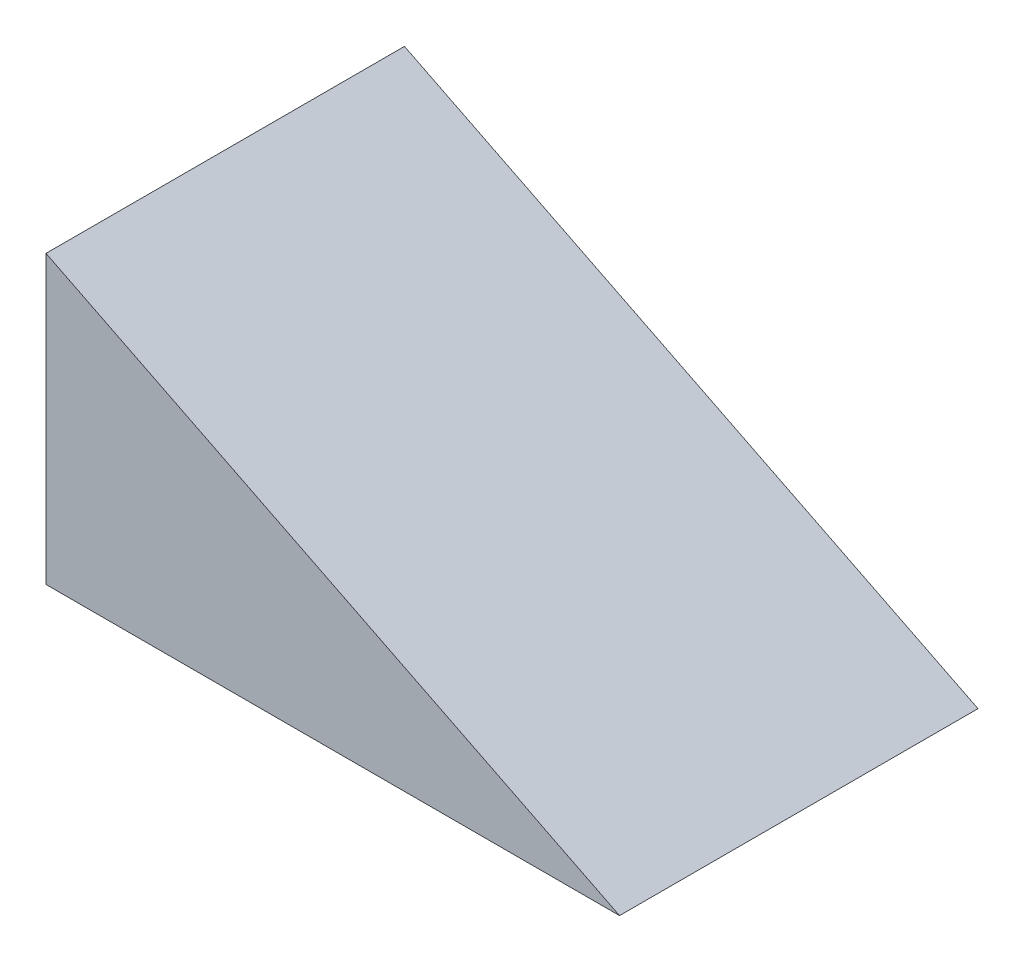
from build123d import *

# Parameters (mm, degrees)
BOSS_EXTRUDE1_DEPTH = 127


with BuildPart() as part:
    # Sketch1 → Boss-Extrude1 (new body)
    with BuildSketch(Plane.XY):
        Polygon((0, 0), (203.2, 0), (0, 101.6), align=None)
    extrude(amount=BOSS_EXTRUDE1_DEPTH)


solid = part.part
